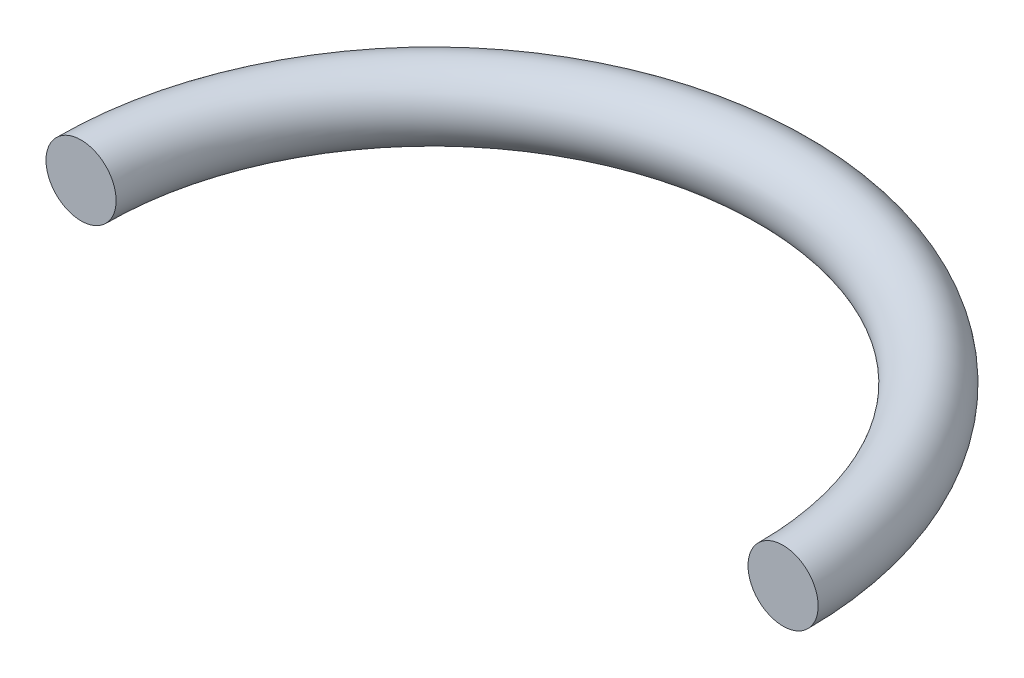
from build123d import *

# Parameters (mm, degrees)
ESQUISSE1_R       = 0.749394307
R_VOLUTION1_ANGLE = 180


with BuildPart() as part:
    # Esquisse1 → Révolution1 (revolve)
    with BuildSketch(Plane.XY):
        with Locations((7.5, 0)):
            Circle(ESQUISSE1_R)
    revolve(axis=Axis((0, -1.85310013, 0), (0, 1, 0)), revolution_arc=R_VOLUTION1_ANGLE)


solid = part.part
